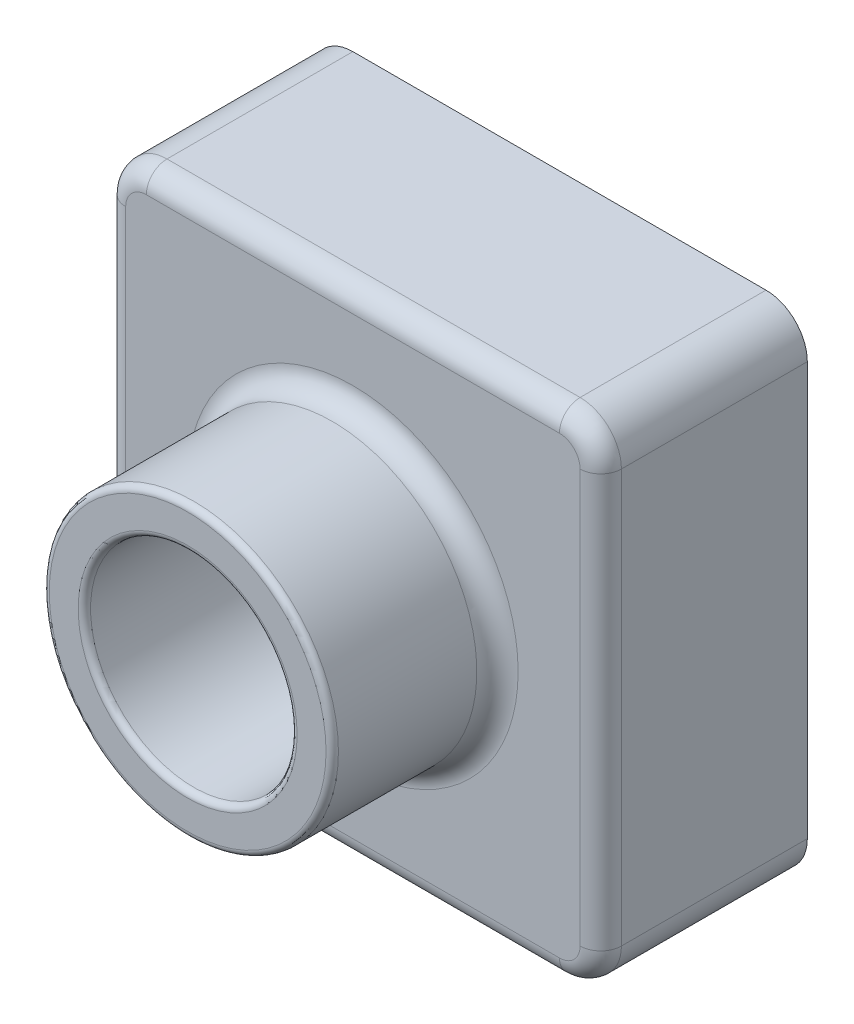
from build123d import *

# Parameters (mm, degrees)
SKETCH1_W           = 120
SKETCH1_H           = 120
BOSS_EXTRUDE1_DEPTH = 50
SKETCH2_R           = 35
BOSS_EXTRUDE2_DEPTH = 40
SKETCH3_R           = 25
CUT_EXTRUDE1_DEPTH  = 193.093727123
FILLET1_R           = 10
FILLET2_R           = 1.5
FILLET3_R           = 5
SHELL1_T            = -2


with BuildPart() as part:
    # Sketch1 → Boss-Extrude1 (new body)
    with BuildSketch(Plane.XY):
        with Locations((60, 60)):
            Rectangle(SKETCH1_W, SKETCH1_H)
    extrude(amount=BOSS_EXTRUDE1_DEPTH)

    # Sketch2 → Boss-Extrude2 (add)
    with BuildSketch(Plane.XY.offset(50)):
        with Locations(Location((60, 60, 0), (0, 0, 180))):
            Circle(SKETCH2_R)
    extrude(amount=BOSS_EXTRUDE2_DEPTH)

    # Sketch3 → Cut-Extrude1 (cut, through all)
    with BuildSketch(Plane.XY.offset(90)):
        with Locations((60, 60)):
            Circle(SKETCH3_R)
    extrude(amount=-CUT_EXTRUDE1_DEPTH, mode=Mode.SUBTRACT)

    # Fillet1
    fillet1_edges = [part.edges().sort_by_distance(p)[0] for p in [
        (0, 120, 25),
        (120, 120, 25),
        (120, 0, 25),
        (0, 0, 25),
    ]]
    fillet(fillet1_edges, radius=FILLET1_R)

    # Fillet2
    fillet2_edges = [part.edges().sort_by_distance(p)[0] for p in [
        (95, 60, 90),
        (35, 60, 90),
    ]]
    fillet(fillet2_edges, radius=FILLET2_R)

    # Fillet3
    fillet3_edges = [part.edges().sort_by_distance(p)[0] for p in [
        (95, 60, 50),
        (0, 60, 50),
        (60, 120, 50),
        (60, 0, 50),
        (120, 60, 50),
        (117.071067812, 117.071067812, 50),
        (117.071067812, 2.928932188, 50),
        (2.928932188, 2.928932188, 50),
        (2.928932188, 117.071067812, 50),
    ]]
    fillet(fillet3_edges, radius=FILLET3_R)

    # Shell1
    shell1_openings = [part.faces().sort_by_distance(p)[0] for p in [
        (60, 1.697056275, 0),
    ]]
    offset(amount=SHELL1_T, openings=shell1_openings, kind=Kind.INTERSECTION)


solid = part.part
